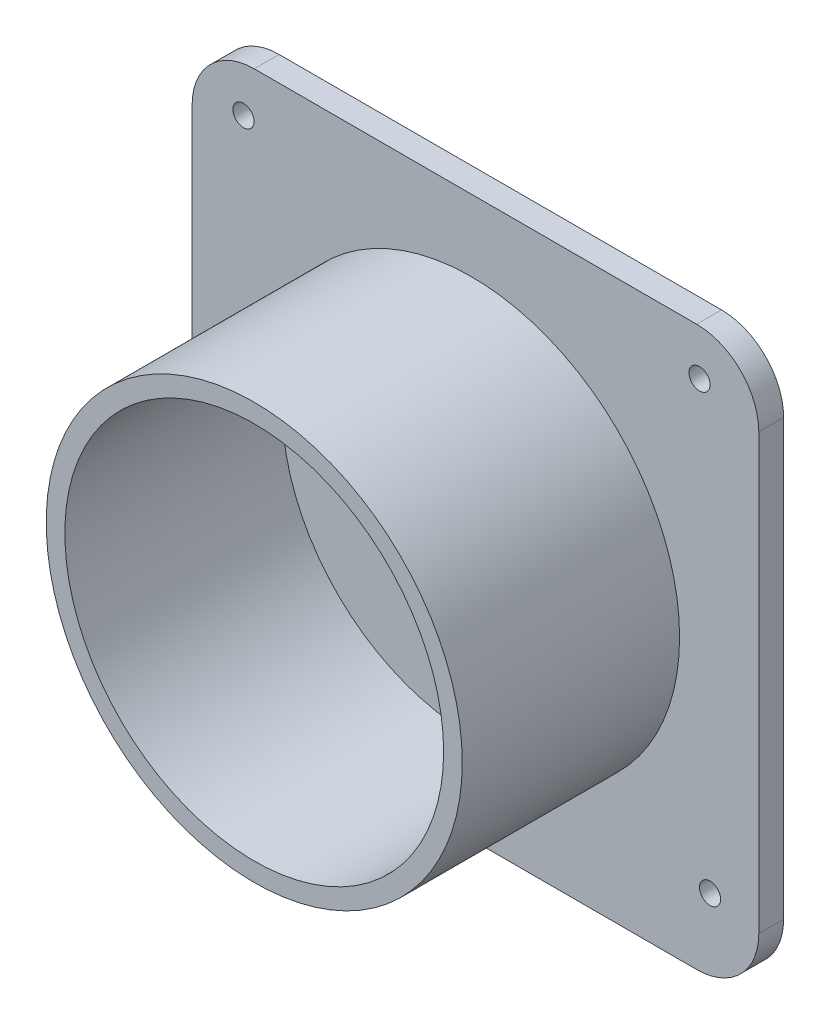
from build123d import *

# Parameters (mm, degrees)
SKETCH1_W           = 170
SKETCH1_H           = 90
BOSS_EXTRUDE1_DEPTH = 5
SKETCH1_3_W         = 170
SKETCH1_3_H         = 90
SKETCH1_3_R         = 3
BOSS_EXTRUDE2_DEPTH = 10
SKETCH1_4_R         = 33.5
SKETCH1_4_R_2       = 30.5
BOSS_EXTRUDE3_DEPTH = 35
SKETCH1_7_R         = 33.5
BOSS_EXTRUDE4_DEPTH = 10
SKETCH3_W           = 78.746322612
SKETCH3_H           = 90
CUT_EXTRUDE3_DEPTH  = 10
SKETCH5_R           = 1.7
CUT_EXTRUDE4_DEPTH  = 10
SKETCH6_W           = 91.253677388
SKETCH6_H           = 90
CUT_EXTRUDE5_DEPTH  = 6
FILLET2_R           = 10


with BuildPart() as part:
    # Sketch1 → Boss-Extrude1 (new body)
    with BuildSketch(Plane.XY):
        with Locations((-0.049117786, 5.583941606)):
            Rectangle(SKETCH1_W, SKETCH1_H)
    extrude(amount=-BOSS_EXTRUDE1_DEPTH)

    # Sketch1<3> → Boss-Extrude2 (add)
    with BuildSketch(Plane.XY):
        with Locations((-0.049117786, 5.583941606)):
            Rectangle(SKETCH1_3_W, SKETCH1_3_H)
        with Locations((-77.306081152, -32.231283052)):
            Circle(SKETCH1_3_R, mode=Mode.SUBTRACT)
        with Locations((75.391495508, -30.531283052)):
            Circle(SKETCH1_3_R, mode=Mode.SUBTRACT)
        with Locations((-77.306081152, 42.827274758)):
            Circle(SKETCH1_3_R, mode=Mode.SUBTRACT)
        with BuildLine():
            ThreePointArc((-80.049117786, 31.219024875), (-70.906982163, 36.441805982), (-65.684201055, 45.583941606))
            Line((-65.684201055, 45.583941606), (65.585965482, 45.583941606))
            ThreePointArc((65.585965482, 45.583941606), (70.80874659, 36.441805982), (79.950882214, 31.219024875))
            Line((79.950882214, 31.219024875), (79.950882214, -20.051141663))
            ThreePointArc((79.950882214, -20.051141663), (70.80874659, -25.27392277), (65.585965482, -34.416058394))
            Line((65.585965482, -34.416058394), (-65.684201055, -34.416058394))
            ThreePointArc((-65.684201055, -34.416058394), (-70.906982163, -25.27392277), (-80.049117786, -20.051141663))
            Line((-80.049117786, -20.051141663), (-80.049117786, 31.219024875))
        make_face(mode=Mode.SUBTRACT)
        with Locations((75.391495508, 41.466476411)):
            Circle(SKETCH1_3_R, mode=Mode.SUBTRACT)
    extrude(amount=-BOSS_EXTRUDE2_DEPTH)

    # Sketch1<4> → Boss-Extrude3 (add)
    with BuildSketch(Plane.XY):
        with Locations((-40.049117786, 5.583941606)):
            Circle(SKETCH1_4_R)
        with Locations((-40.049117786, 5.583941606)):
            Circle(SKETCH1_4_R_2, mode=Mode.SUBTRACT)
    extrude(amount=BOSS_EXTRUDE3_DEPTH)

    # Sketch1<7> → Boss-Extrude4 (add)
    with BuildSketch(Plane.XY):
        with BuildLine():
            Line((65.585965482, 45.583941606), (-65.684201055, 45.583941606))
            ThreePointArc((-65.684201055, 45.583941606), (-70.906982163, 36.441805982), (-80.049117786, 31.219024875))
            Line((-80.049117786, 31.219024875), (-80.049117786, -20.051141663))
            ThreePointArc((-80.049117786, -20.051141663), (-70.906982163, -25.27392277), (-65.684201055, -34.416058394))
            Line((-65.684201055, -34.416058394), (65.585965482, -34.416058394))
            ThreePointArc((65.585965482, -34.416058394), (70.80874659, -25.27392277), (79.950882214, -20.051141663))
            Line((79.950882214, -20.051141663), (79.950882214, 31.219024875))
            ThreePointArc((79.950882214, 31.219024875), (70.80874659, 36.441805982), (65.585965482, 45.583941606))
        make_face()
        with Locations((-40.049117786, 5.583941606)):
            Circle(SKETCH1_7_R, mode=Mode.SUBTRACT)
    extrude(amount=-BOSS_EXTRUDE4_DEPTH)

    # Sketch3 → Cut-Extrude3 (cut)
    with BuildSketch(Plane.XY):
        with Locations((45.577720908, 5.583941606)):
            Rectangle(SKETCH3_W, SKETCH3_H)
    extrude(amount=-CUT_EXTRUDE3_DEPTH, mode=Mode.SUBTRACT)

    # Sketch5 → Cut-Extrude4 (cut)
    with BuildSketch(Plane.XY):
        with Locations((-76.777993439, 43.20743885)):
            Circle(SKETCH5_R)
        with Locations((-3.340612715, 43.20743885)):
            Circle(SKETCH5_R)
        with Locations((-76.777993439, -29.399888528)):
            Circle(SKETCH5_R)
        with Locations((-1.640612715, -27.699888528)):
            Circle(SKETCH5_R)
    extrude(amount=-CUT_EXTRUDE4_DEPTH, mode=Mode.SUBTRACT)

    # Sketch6 → Cut-Extrude5 (cut)
    with BuildSketch(Plane(origin=(0, 0, -10), x_dir=(-1, 0, 0), z_dir=(0, 0, -1))):
        with Locations((39.422279092, 5.583941606)):
            Rectangle(SKETCH6_W, SKETCH6_H)
    extrude(amount=-CUT_EXTRUDE5_DEPTH, mode=Mode.SUBTRACT)

    # Fillet2
    fillet2_edges = [part.edges().sort_by_distance(p)[0] for p in [
        (-85.049117786, -39.416058394, -2),
        (6.204559602, -39.416058394, -2),
        (6.204559602, 50.583941606, -2),
        (-85.049117786, 50.583941606, -2),
    ]]
    fillet(fillet2_edges, radius=FILLET2_R)


solid = part.part
